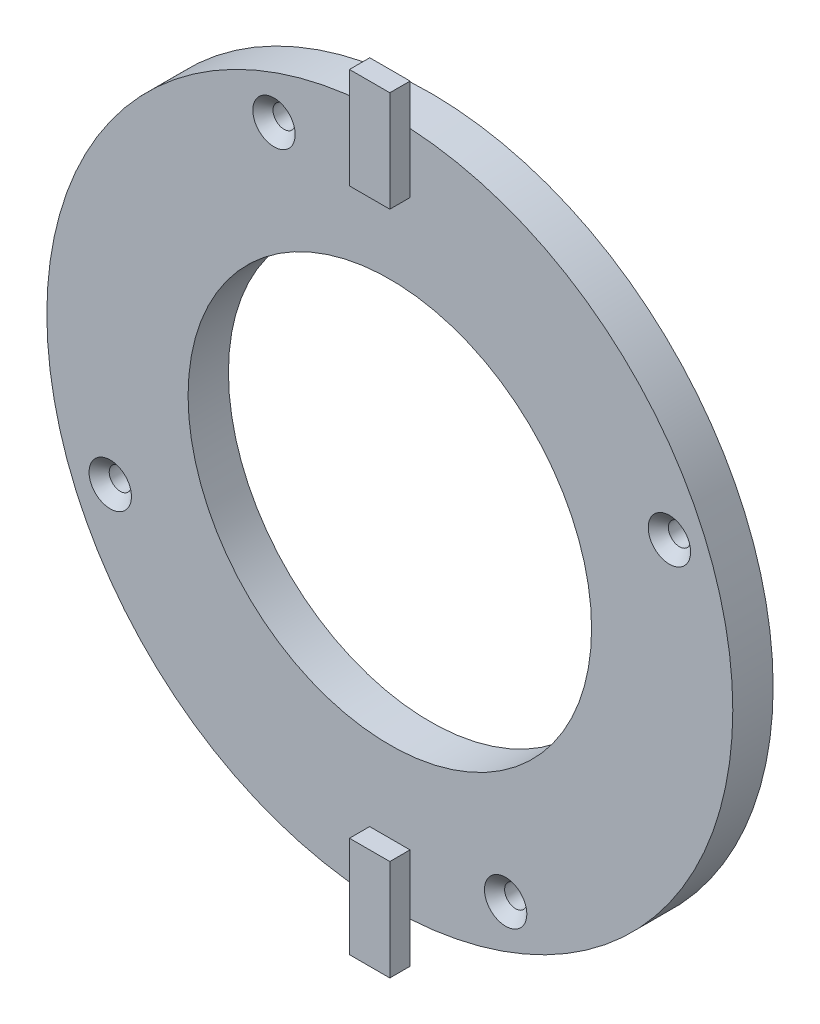
from build123d import *

# Parameters (mm, degrees)
SKETCH1_R                                    = 34
SKETCH1_R_2                                  = 20
OUTPUT_PLATE_DEPTH                           = 4
Y_TONGUE_1_START                             = 3.99
SKETCH2_W                                    = 4
SKETCH2_H                                    = 10
Y_TONGUE_1_DEPTH                             = 2.01
SKETCH3_W                                    = 4
SKETCH3_H                                    = 10
Y_TONGUE_1_2_DEPTH                           = 2.01
SKETCH4_R                                    = 1.1
FOUR_M2_CLEARANCE_DEPTH                      = 4.01
SKETCH5_R                                    = 2.1
FOUR_90DEG_COUNTERSINKS_D4P2_DEPTH           = 1.1
FOUR_90DEG_COUNTERSINKS_D4P2_DRAFT           = -45
FOUR_90DEG_COUNTERSINKS_D4P2_PROFILE_2_DEPTH = 1.1
FOUR_90DEG_COUNTERSINKS_D4P2_PROFILE_2_DRAFT = -45
FOUR_90DEG_COUNTERSINKS_D4P2_PROFILE_3_DEPTH = 1.1
FOUR_90DEG_COUNTERSINKS_D4P2_PROFILE_3_DRAFT = -45
FOUR_90DEG_COUNTERSINKS_D4P2_PROFILE_4_DEPTH = 1.1
FOUR_90DEG_COUNTERSINKS_D4P2_PROFILE_4_DRAFT = -45
SKETCH6_R                                    = 1.51
FOUR_STANDOFF_PILOT_POCKETS_D3P02_DEPTH      = 1.1


with BuildPart() as part:
    # Sketch1 → Output_Plate (new body)
    with BuildSketch(Plane.XY):
        Circle(SKETCH1_R)
        Circle(SKETCH1_R_2, mode=Mode.SUBTRACT)
    extrude(amount=OUTPUT_PLATE_DEPTH)

    # Sketch2 → Y_Tongue_-1 (add)
    with BuildSketch(Plane.XY.offset(Y_TONGUE_1_START)):
        with Locations((0, -33)):
            Rectangle(SKETCH2_W, SKETCH2_H)
    extrude(amount=Y_TONGUE_1_DEPTH)

    # Sketch3 → Y_Tongue_1 2 (add)
    with BuildSketch(Plane.XY.offset(Y_TONGUE_1_START)):
        with Locations((0, 33)):
            Rectangle(SKETCH3_W, SKETCH3_H)
    extrude(amount=Y_TONGUE_1_2_DEPTH)

    # Sketch4 → Four_M2_Clearance (cut)
    with BuildSketch(Plane.XY.offset(4)):
        with Locations((27.716385975, 11.480502971)):
            Circle(SKETCH4_R)
        with Locations((-11.480502971, 27.716385975)):
            Circle(SKETCH4_R)
        with Locations((-27.716385975, -11.480502971)):
            Circle(SKETCH4_R)
        with Locations((11.480502971, -27.716385975)):
            Circle(SKETCH4_R)
    extrude(amount=-FOUR_M2_CLEARANCE_DEPTH, mode=Mode.SUBTRACT)


with BuildPart() as four_90deg_countersinks_d4p2_tool:
    # Sketch5 → Four_90deg_Countersinks_D4p2 (with draft: the straight prism first)
    with BuildSketch(Plane.XY.offset(4)):
        with Locations((27.716385975, 11.480502971)):
            Circle(SKETCH5_R)
    extrude(amount=-FOUR_90DEG_COUNTERSINKS_D4P2_DEPTH)
    # Four_90deg_Countersinks_D4p2: the draft: its side faces are tilted about the plane it starts from
    four_90deg_countersinks_d4p2_sides = [four_90deg_countersinks_d4p2_tool.faces().sort_by_distance(p)[0] for p in [
        (25.616385975, 11.480502971, 3.45),
    ]]
    draft(four_90deg_countersinks_d4p2_sides, Plane.XY.offset(4), FOUR_90DEG_COUNTERSINKS_D4P2_DRAFT)


with BuildPart() as part_1:
    add(part.part)

    # Four_90deg_Countersinks_D4p2: cut by four_90deg_countersinks_d4p2_tool
    add(four_90deg_countersinks_d4p2_tool.part, mode=Mode.SUBTRACT)


with BuildPart() as four_90deg_countersinks_d4p2_profile_2_tool:
    # Sketch5 → Four_90deg_Countersinks_D4p2 profile 2 (with draft: the straight prism first)
    with BuildSketch(Plane.XY.offset(4)):
        with Locations((-11.480502971, 27.716385975)):
            Circle(SKETCH5_R)
    extrude(amount=-FOUR_90DEG_COUNTERSINKS_D4P2_PROFILE_2_DEPTH)
    # Four_90deg_Countersinks_D4p2 profile 2: the draft: its side faces are tilted about the plane it starts from
    four_90deg_countersinks_d4p2_profile_2_sides = [four_90deg_countersinks_d4p2_profile_2_tool.faces().sort_by_distance(p)[0] for p in [
        (-13.580502971, 27.716385975, 3.45),
    ]]
    draft(four_90deg_countersinks_d4p2_profile_2_sides, Plane.XY.offset(4), FOUR_90DEG_COUNTERSINKS_D4P2_PROFILE_2_DRAFT)


with BuildPart() as part_2:
    add(part_1.part)

    # Four_90deg_Countersinks_D4p2 profile 2: cut by four_90deg_countersinks_d4p2_profile_2_tool
    add(four_90deg_countersinks_d4p2_profile_2_tool.part, mode=Mode.SUBTRACT)


with BuildPart() as four_90deg_countersinks_d4p2_profile_3_tool:
    # Sketch5 → Four_90deg_Countersinks_D4p2 profile 3 (with draft: the straight prism first)
    with BuildSketch(Plane.XY.offset(4)):
        with Locations((-27.716385975, -11.480502971)):
            Circle(SKETCH5_R)
    extrude(amount=-FOUR_90DEG_COUNTERSINKS_D4P2_PROFILE_3_DEPTH)
    # Four_90deg_Countersinks_D4p2 profile 3: the draft: its side faces are tilted about the plane it starts from
    four_90deg_countersinks_d4p2_profile_3_sides = [four_90deg_countersinks_d4p2_profile_3_tool.faces().sort_by_distance(p)[0] for p in [
        (-29.816385975, -11.480502971, 3.45),
    ]]
    draft(four_90deg_countersinks_d4p2_profile_3_sides, Plane.XY.offset(4), FOUR_90DEG_COUNTERSINKS_D4P2_PROFILE_3_DRAFT)


with BuildPart() as part_3:
    add(part_2.part)

    # Four_90deg_Countersinks_D4p2 profile 3: cut by four_90deg_countersinks_d4p2_profile_3_tool
    add(four_90deg_countersinks_d4p2_profile_3_tool.part, mode=Mode.SUBTRACT)


with BuildPart() as four_90deg_countersinks_d4p2_profile_4_tool:
    # Sketch5 → Four_90deg_Countersinks_D4p2 profile 4 (with draft: the straight prism first)
    with BuildSketch(Plane.XY.offset(4)):
        with Locations((11.480502971, -27.716385975)):
            Circle(SKETCH5_R)
    extrude(amount=-FOUR_90DEG_COUNTERSINKS_D4P2_PROFILE_4_DEPTH)
    # Four_90deg_Countersinks_D4p2 profile 4: the draft: its side faces are tilted about the plane it starts from
    four_90deg_countersinks_d4p2_profile_4_sides = [four_90deg_countersinks_d4p2_profile_4_tool.faces().sort_by_distance(p)[0] for p in [
        (9.380502971, -27.716385975, 3.45),
    ]]
    draft(four_90deg_countersinks_d4p2_profile_4_sides, Plane.XY.offset(4), FOUR_90DEG_COUNTERSINKS_D4P2_PROFILE_4_DRAFT)


with BuildPart() as part_4:
    add(part_3.part)

    # Four_90deg_Countersinks_D4p2 profile 4: cut by four_90deg_countersinks_d4p2_profile_4_tool
    add(four_90deg_countersinks_d4p2_profile_4_tool.part, mode=Mode.SUBTRACT)

    # Sketch6 → Four_Standoff_Pilot_Pockets_D3p02 (cut)
    with BuildSketch(Plane(origin=(0, 0, 0), x_dir=(-1, 0, 0), z_dir=(0, 0, -1))):
        with Locations((-27.716385975, 11.480502971)):
            Circle(SKETCH6_R)
        with Locations((11.480502971, 27.716385975)):
            Circle(SKETCH6_R)
        with Locations((27.716385975, -11.480502971)):
            Circle(SKETCH6_R)
        with Locations((-11.480502971, -27.716385975)):
            Circle(SKETCH6_R)
    extrude(amount=-FOUR_STANDOFF_PILOT_POCKETS_D3P02_DEPTH, mode=Mode.SUBTRACT)


solid = part_4.part
